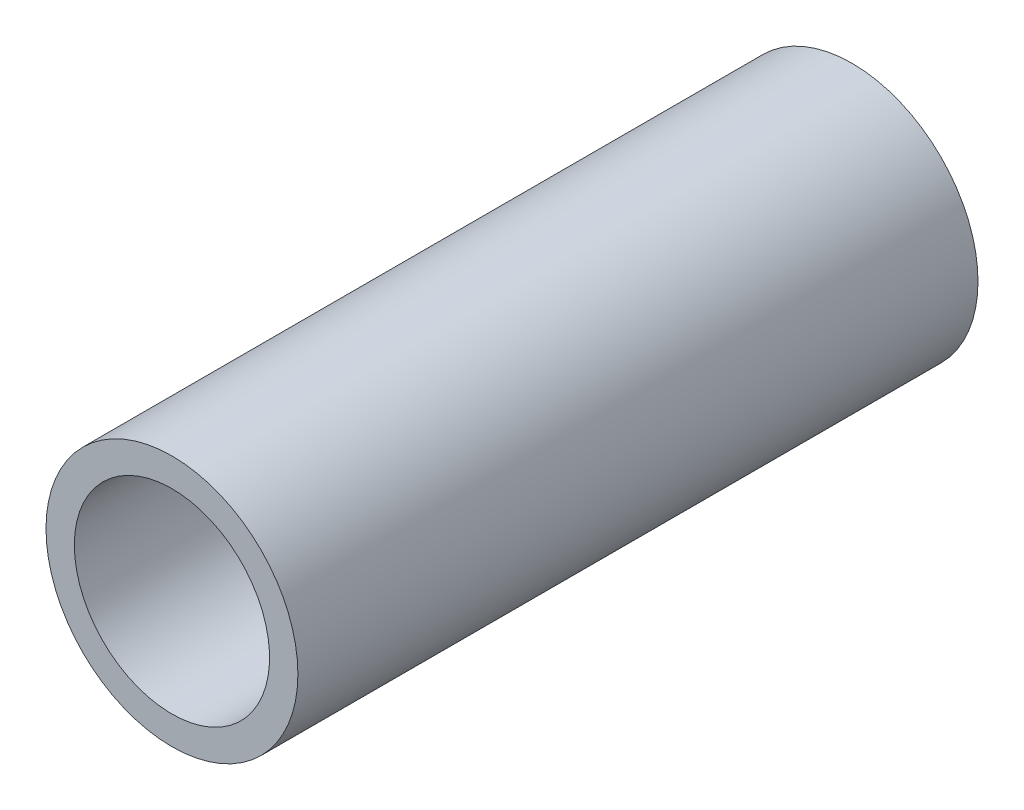
from build123d import *

# Parameters (mm, degrees)
SKETCH_1_R      = 1
SKETCH_1_R_2    = 0.775
EXTRUDE_1_DEPTH = 5.4


with BuildPart() as part:
    # Эскиз1 → Бобышка-Вытянуть1 (new body)
    with BuildSketch(Plane.XY):
        with Locations(Location((0, 0, 0), (0, 0, 180))):
            Circle(SKETCH_1_R)
        with Locations(Location((0, 0, 0), (0, 0, 180))):
            Circle(SKETCH_1_R_2, mode=Mode.SUBTRACT)
    extrude(amount=EXTRUDE_1_DEPTH)


solid = part.part
